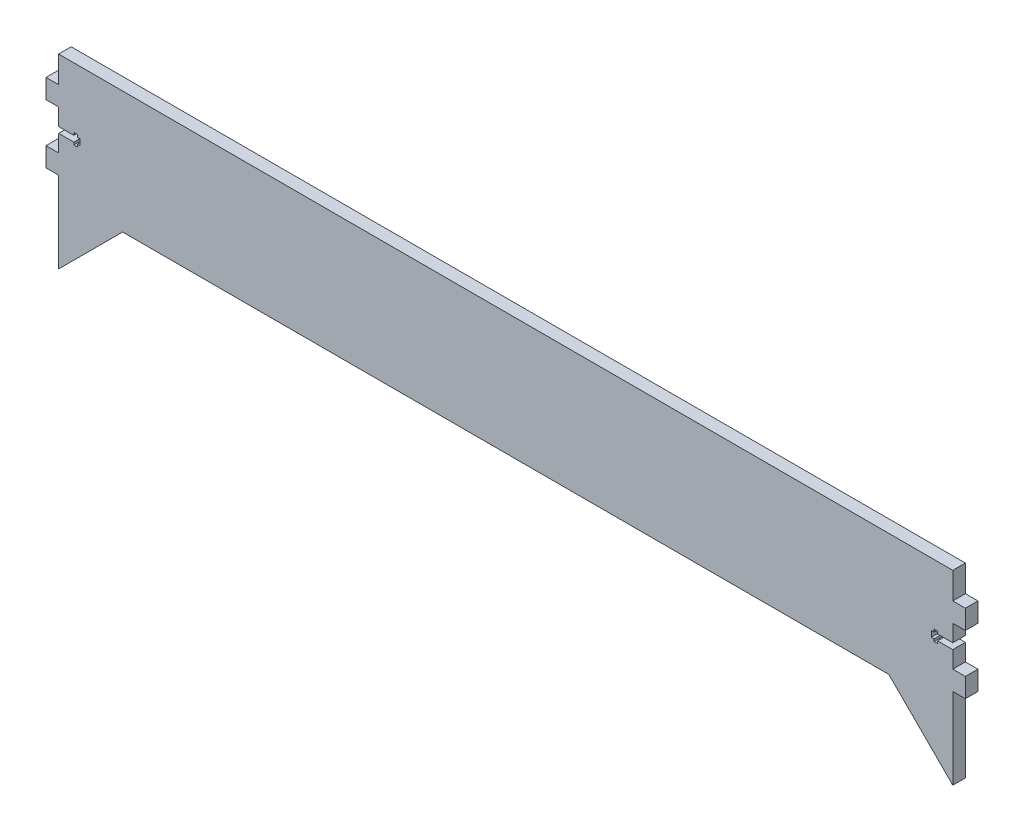
from build123d import *

# Parameters (mm, degrees)
BOSS_EXTRUDE1_DEPTH = 6.4


with BuildPart() as part:
    # Sketch1 → Boss-Extrude1 (new body)
    with BuildSketch(Plane.XY):
        Polygon((-194.225982734, 22.242984131), (194.783694686, 22.242984131), (227.278855976, -10.25217716), (227.278855976, 30.97782284), (233.678855976, 30.97782284), (233.678855976, 40.77782284), (227.278855976, 40.77782284), (227.278855976, 49.377143254), (219.578855976, 49.377143254), (219.578855976, 48.128502427), (217.778855976, 48.128502427), (217.778855976, 49.377143254), (216.378855976, 49.377143254), (216.378855976, 52.378502427), (217.778855976, 52.378502427), (217.778855976, 53.628502427), (219.578855976, 53.628502427), (219.578855976, 52.378502427), (227.278855976, 52.378502427), (227.278855976, 60.97782284), (233.678855976, 60.97782284), (233.678855976, 70.77782284), (227.278855976, 70.77782284), (227.278855976, 84.24782284), (-226.721144024, 84.24782284), (-226.721144024, 70.77782284), (-233.121144024, 70.77782284), (-233.121144024, 60.97782284), (-226.721144024, 60.97782284), (-226.721144024, 52.378502427), (-219.021144024, 52.378502427), (-219.021144024, 53.628502427), (-217.221144024, 53.628502427), (-217.221144024, 52.378502427), (-215.821144024, 52.378502427), (-215.821144024, 49.377143254), (-217.221144024, 49.377143254), (-217.221144024, 48.128502427), (-219.021144024, 48.128502427), (-219.021144024, 49.377143254), (-226.721144024, 49.377143254), (-226.721144024, 40.77782284), (-233.121144024, 40.77782284), (-233.121144024, 30.97782284), (-226.721144024, 30.97782284), (-226.721144024, -10.25217716), align=None)
    extrude(amount=BOSS_EXTRUDE1_DEPTH)


solid = part.part
